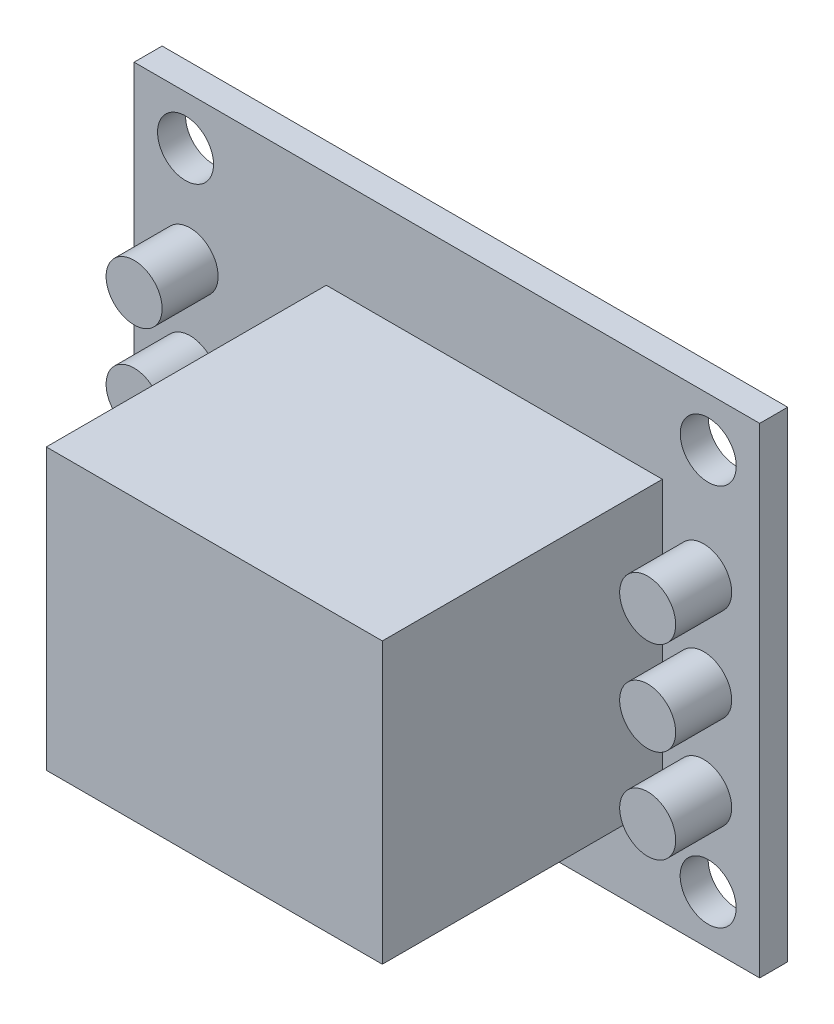
from build123d import *

# Parameters (mm, degrees)
SKETCH_1_W      = 33.51
SKETCH_1_H      = 25.73
SKETCH_1_R      = 1.5
EXTRUDE_1_DEPTH = 1.5
SKETCH_2_W      = 18
SKETCH_2_H      = 15
EXTRUDE_2_DEPTH = 15
SKETCH_3_R      = 1.5
EXTRUDE_3_DEPTH = 3


with BuildPart() as part:
    # 草圖1 → 填料-伸長1 (new body)
    with BuildSketch(Plane.XY):
        with Locations((2.525137649, -0.176232877)):
            Rectangle(SKETCH_1_W, SKETCH_1_H)
        with Locations((-11.474862351, 10.073766514)):
            Circle(SKETCH_1_R, mode=Mode.SUBTRACT)
        with Locations((-11.479862351, -10.426232877)):
            Circle(SKETCH_1_R, mode=Mode.SUBTRACT)
        with Locations((16.520137649, -10.426232877)):
            Circle(SKETCH_1_R, mode=Mode.SUBTRACT)
        with Locations((16.525137649, 10.073766514)):
            Circle(SKETCH_1_R, mode=Mode.SUBTRACT)
    extrude(amount=EXTRUDE_1_DEPTH)

    # 草圖2 → 填料-伸長2 (add)
    with BuildSketch(Plane.XY.offset(1.5)):
        with Locations((5.066714054, -0.011232877)):
            Rectangle(SKETCH_2_W, SKETCH_2_H)
    extrude(amount=EXTRUDE_2_DEPTH)

    # 草圖3 → 填料-伸長3 (add)
    with BuildSketch(Plane.XY.offset(1.5)):
        with Locations((-11.229862351, 5)):
            Circle(SKETCH_3_R)
        with Locations((-11.229862351, 0)):
            Circle(SKETCH_3_R)
        with Locations((-11.229862351, -5)):
            Circle(SKETCH_3_R)
        with Locations((16.280137649, 4.100671386)):
            Circle(SKETCH_3_R)
        with Locations((16.280137649, -0.899328614)):
            Circle(SKETCH_3_R)
        with Locations((16.280137649, -5.899328614)):
            Circle(SKETCH_3_R)
    extrude(amount=EXTRUDE_3_DEPTH)


solid = part.part
